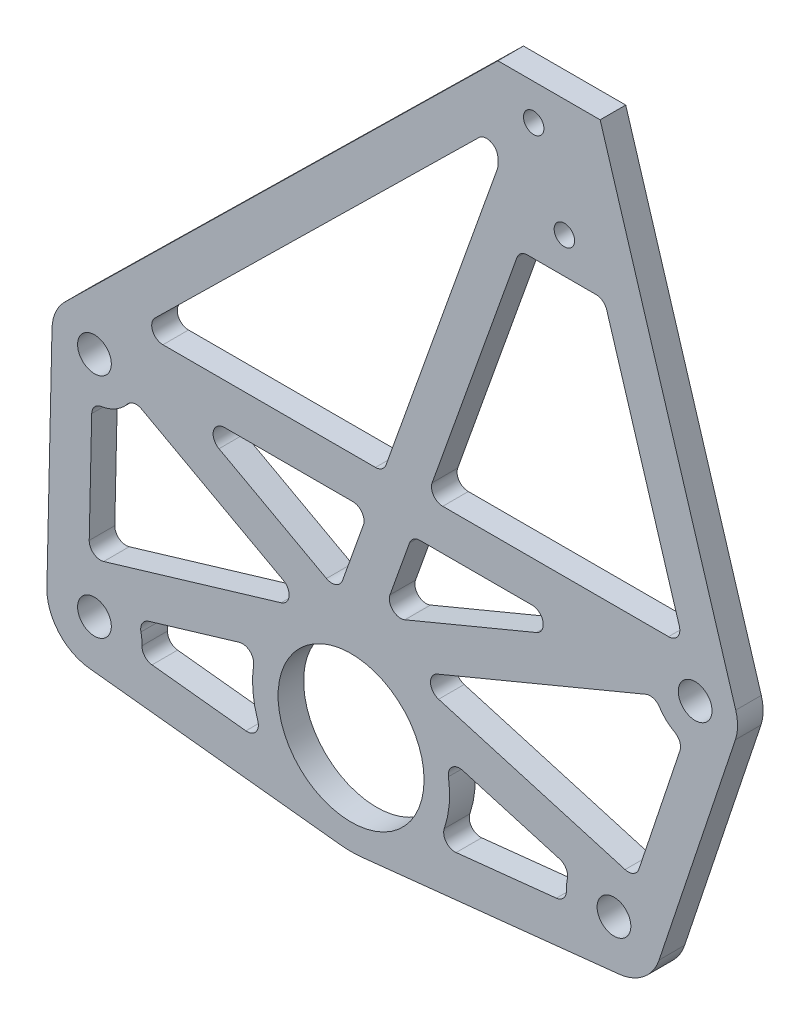
from build123d import *

# Parameters (mm, degrees)
SKETCH1_R           = 3.302
SKETCH1_R_2         = 14.2748
SKETCH1_R_3         = 2
BOSS_EXTRUDE1_DEPTH = 5
FILLET1_R           = 2.2


with BuildPart() as part:
    # Sketch1 → Boss-Extrude1 (new body)
    with BuildSketch(Plane.XY):
        with BuildLine():
            Line((49.732074359, 129.130431425), (29.732074359, 129.130431425))
            Line((29.732074359, 129.130431425), (-54.986003567, 45.902692248))
            ThreePointArc((-54.986003567, 45.902692248), (-56.787195673, 43.277388838), (-57.467824457, 40.167203079))
            Line((-57.467824457, 40.167203079), (-58.467571363, -4.260299734))
            ThreePointArc((-58.467571363, -4.260299734), (-56.161422432, -10.602936869), (-50.173941362, -13.717008024))
            Line((-50.173941362, -13.717008024), (-1.066715703, -19.05931292))
            ThreePointArc((-1.066715703, -19.05931292), (0.992574977, -19.172351986), (3.052155178, -19.06471679))
            Line((3.052155178, -19.06471679), (53.413821776, -13.719615927))
            ThreePointArc((53.413821776, -13.719615927), (58.261915472, -11.718027487), (61.25647558, -7.411871598))
            Line((61.25647558, -7.411871598), (76.182819246, 37.354437047))
            ThreePointArc((76.182819246, 37.354437047), (76.608419263, 39.876139592), (76.246305111, 42.407738382))
            Line((76.246305111, 42.407738382), (49.732074359, 129.130431425))
        make_face()
        with Locations((-49.167925641, -4.469568575)):
            Circle(SKETCH1_R, mode=Mode.SUBTRACT)
        with BuildLine():
            Line((-15.743011398, -9.415499117), (-40.152332132, -6.760044))
            ThreePointArc((-40.152332132, -6.760044), (-39.904287902, -3.625637398), (-40.714646148, -0.587652835))
            Line((-40.714646148, -0.587652835), (-17.187009107, 6.434930438))
            ThreePointArc((-17.187009107, 6.434930438), (-18.177445963, -1.64628978), (-15.743011398, -9.415499117))
        make_face(mode=Mode.SUBTRACT)
        with Locations((1.017863078, 0.102431425)):
            Circle(SKETCH1_R_2, mode=Mode.SUBTRACT)
        with BuildLine():
            ThreePointArc((-49.656497245, 31.692820081), (-45.010872906, 32.79418647), (-41.740102305, 36.27224528))
            Line((-41.740102305, 36.27224528), (-7.597542604, 17.645980927))
            Line((-7.597542604, 17.645980927), (-50.259137287, 4.912249924))
            Line((-50.259137287, 4.912249924), (-49.656497245, 31.692820081))
        make_face(mode=Mode.SUBTRACT)
        with Locations((-49.167925641, 39.980431425)):
            Circle(SKETCH1_R, mode=Mode.SUBTRACT)
        Polygon((-32.386395914, 40.282431425), (4.475234555, 40.282431425), (-1.533823666, 23.450999579), align=None, mode=Mode.SUBTRACT)
        with BuildLine():
            ThreePointArc((60.530999596, 37.07253437), (62.657762713, 33.896971725), (65.981819268, 32.010714193))
            Line((65.981819268, 32.010714193), (56.592331805, 3.850254859))
            ThreePointArc((56.592331805, 3.850254859), (55.825298544, 4.191449473), (55.030627874, 4.462101125))
            Line((55.030627874, 4.462101125), (12.139397937, 16.940748464))
            Line((12.139397937, 16.940748464), (60.530999596, 37.07253437))
        make_face(mode=Mode.SUBTRACT)
        with BuildLine():
            ThreePointArc((17.753705258, -9.459446089), (20.216903145, -1.60483995), (19.178334944, 6.561160143))
            Line((19.178334944, 6.561160143), (43.95204944, -0.646430941))
            ThreePointArc((43.95204944, -0.646430941), (43.16663603, -3.645641046), (43.410501788, -6.736379627))
            Line((43.410501788, -6.736379627), (17.753705258, -9.459446089))
        make_face(mode=Mode.SUBTRACT)
        with Locations((52.432074359, -4.469568575)):
            Circle(SKETCH1_R, mode=Mode.SUBTRACT)
        Polygon((12.969784548, 40.282431425), (47.419131213, 40.282431425), (6.960726327, 23.450999579), align=None, mode=Mode.SUBTRACT)
        with Locations((68.307074359, 39.980431425)):
            Circle(SKETCH1_R, mode=Mode.SUBTRACT)
        Polygon((-41.148197142, 48.282431425), (29.732074359, 117.915795328), (29.732074359, 111.027090937), (7.331347226, 48.282431425), align=None, mode=Mode.SUBTRACT)
        Polygon((66.084655222, 48.282431425), (15.825897219, 48.282431425), (33.979349356, 99.130431425), (50.538601957, 99.130431425), align=None, mode=Mode.SUBTRACT)
        with Locations((36.732074359, 122.130431425)):
            Circle(SKETCH1_R_3, mode=Mode.SUBTRACT)
        with Locations((42.732074359, 106.130431425)):
            Circle(SKETCH1_R_3, mode=Mode.SUBTRACT)
    extrude(amount=BOSS_EXTRUDE1_DEPTH)

    # Fillet1
    fillet1_edges = [part.edges().sort_by_distance(p)[0] for p in [
        (43.95204944, -0.646430941, 2.5),
        (43.410501788, -6.736379627, 2.5),
        (-40.152332132, -6.760044, 2.5),
        (-40.714646148, -0.587652835, 2.5),
        (-41.148197142, 48.282431425, 2.5),
        (7.331347226, 48.282431425, 2.5),
        (66.084655222, 48.282431425, 2.5),
        (6.960726327, 23.450999579, 2.5),
        (47.419131213, 40.282431425, 2.5),
        (-49.656497245, 31.692820081, 2.5),
        (-41.740102305, 36.27224528, 2.5),
        (-50.259137287, 4.912249924, 2.5),
        (-32.386395914, 40.282431425, 2.5),
        (4.475234555, 40.282431425, 2.5),
        (12.969784548, 40.282431425, 2.5),
        (12.139397937, 16.940748464, 2.5),
        (60.530999596, 37.07253437, 2.5),
        (65.981819268, 32.010714193, 2.5),
        (56.592331805, 3.850254859, 2.5),
        (17.753705258, -9.459446089, 2.5),
        (19.178334944, 6.561160143, 2.5),
        (-15.743011398, -9.415499117, 2.5),
        (-17.187009107, 6.434930438, 2.5),
        (-7.597542604, 17.645980927, 2.5),
        (-1.533823666, 23.450999579, 2.5),
        (33.979349356, 99.130431425, 2.5),
        (15.825897219, 48.282431425, 2.5),
        (50.538601957, 99.130431425, 2.5),
        (29.732074359, 117.915795328, 2.5),
        (29.732074359, 111.027090937, 2.5),
    ]]
    fillet(fillet1_edges, radius=FILLET1_R)


solid = part.part
